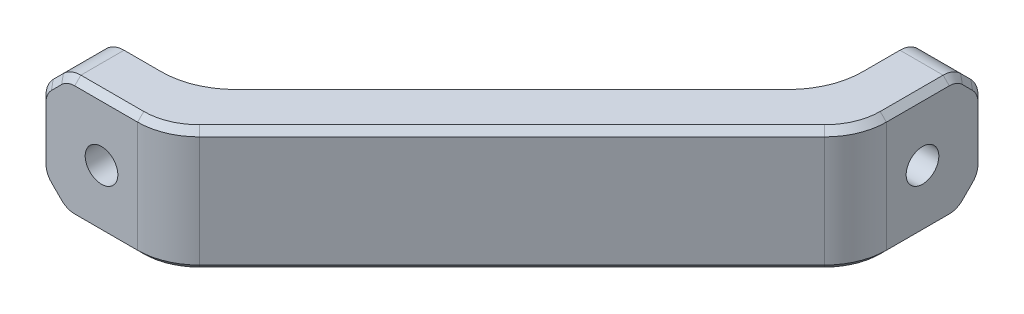
from build123d import *

# Parameters (mm, degrees)
BOSS_EXTRUDE1_DEPTH = 20
SKETCH2_R           = 2.65
CUT_EXTRUDE1_DEPTH  = 20
SKETCH3_R           = 2.65
CUT_EXTRUDE2_DEPTH  = 20
SKETCH7_R           = 6
CUT_EXTRUDE4_DEPTH  = 5
SKETCH8_R           = 6
CUT_EXTRUDE5_DEPTH  = 5
CHAMFER3_SIZE       = 4
FILLET2_R           = 4
CHAMFER4_SIZE       = 2
CHAMFER5_SIZE       = 1


with BuildPart() as part:
    # Sketch1 → Boss-Extrude1 (new body)
    with BuildSketch(Plane(origin=(0, 0, 0), x_dir=(1, 0, 0), z_dir=(0, 1, 0))):
        with BuildLine():
            Line((-4.142135624, 0), (-20, 0))
            Line((-20, 0), (-20, 10))
            Line((-20, 10), (-8.284271247, 10))
            ThreePointArc((-8.284271247, 10), (-4.457436924, 10.761204675), (-1.213203436, 12.928932188))
            Line((-1.213203436, 12.928932188), (43.639610307, 57.781745931))
            ThreePointArc((43.639610307, 57.781745931), (45.80733782, 61.025979419), (46.568542495, 64.852813742))
            Line((46.568542495, 64.852813742), (46.568542495, 76.568542495))
            Line((46.568542495, 76.568542495), (56.568542495, 76.568542495))
            Line((56.568542495, 76.568542495), (56.568542495, 60.710678119))
            ThreePointArc((56.568542495, 60.710678119), (55.80733782, 56.883843795), (53.639610307, 53.639610307))
            Line((53.639610307, 53.639610307), (2.928932188, 2.928932188))
            ThreePointArc((2.928932188, 2.928932188), (-0.3153013, 0.761204675), (-4.142135624, 0))
        make_face()
    extrude(amount=BOSS_EXTRUDE1_DEPTH)

    # Sketch2 → Cut-Extrude1 (cut)
    with BuildSketch(Plane.XY):
        with Locations((-10, 10)):
            Circle(SKETCH2_R)
    extrude(amount=-CUT_EXTRUDE1_DEPTH, mode=Mode.SUBTRACT)

    # Sketch3 → Cut-Extrude2 (cut)
    with BuildSketch(Plane(origin=(56.568542495, 0, 0), x_dir=(0, 0, -1), z_dir=(1, 0, 0))):
        with Locations((66.568542495, 10)):
            Circle(SKETCH3_R)
    extrude(amount=-CUT_EXTRUDE2_DEPTH, mode=Mode.SUBTRACT)

    # Sketch7 → Cut-Extrude4 (cut)
    with BuildSketch(Plane.ZY.offset(-46.568542495)):
        with Locations((-66.568542495, 10)):
            Circle(SKETCH7_R)
    extrude(amount=CUT_EXTRUDE4_DEPTH, mode=Mode.SUBTRACT)

    # Sketch8 → Cut-Extrude5 (cut)
    with BuildSketch(Plane(origin=(0, 0, -10), x_dir=(-1, 0, 0), z_dir=(0, 0, -1))):
        with Locations((10, 10)):
            Circle(SKETCH8_R)
    extrude(amount=CUT_EXTRUDE5_DEPTH, mode=Mode.SUBTRACT)

    # Chamfer3
    chamfer3_edges = [part.edges().sort_by_distance(p)[0] for p in [
        (51.568542495, 0, -76.568542495),
        (-20, 0, -5),
        (51.568542495, 20, -76.568542495),
        (-20, 20, -5),
    ]]
    chamfer(chamfer3_edges, length=CHAMFER3_SIZE)

    # Fillet2
    fillet2_edges = [part.edges().sort_by_distance(p)[0] for p in [
        (-16, 20, -5),
        (51.568542495, 20, -72.568542495),
        (51.568542495, 4, -76.568542495),
        (51.568542495, 16, -76.568542495),
        (-16, 0, -5),
        (51.568542495, 0, -72.568542495),
        (-20, 16, -5),
        (-20, 4, -5),
    ]]
    fillet(fillet2_edges, radius=FILLET2_R)

    # Chamfer4
    chamfer4_edges = [part.edges().sort_by_distance(p)[0] for p in [
        (46.568542495, 20, -67.882250994),
        (46.568542495, 18, -74.568542495),
        (46.568542495, 2, -74.568542495),
        (46.568542495, 0, -67.882250994),
        (46.568542495, 15.87387948, -76.264060625),
        (46.568542495, 19.69551813, -72.442421975),
        (46.568542495, 0.30448187, -72.442421975),
        (46.568542495, 4.12612052, -76.264060625),
        (-18, 18, -10),
        (-11.313708499, 0, -10),
        (-18, 2, -10),
        (-20, 10, -10),
        (-19.69551813, 4.12612052, -10),
        (-15.87387948, 0.30448187, -10),
        (-19.69551813, 15.87387948, -10),
        (-15.87387948, 19.69551813, -10),
        (-4.457436924, 0, -10.761204675),
        (21.213203436, 0, -35.355339059),
        (45.80733782, 0, -61.025979419),
        (45.80733782, 20, -61.025979419),
        (21.213203436, 20, -35.355339059),
        (-4.457436924, 20, -10.761204675),
        (-11.313708499, 20, -10),
        (46.568542495, 10, -76.568542495),
    ]]
    chamfer(chamfer4_edges, length=CHAMFER4_SIZE)

    # Chamfer5
    chamfer5_edges = [part.edges().sort_by_distance(p)[0] for p in [
        (56.568542495, 2, -74.568542495),
        (56.568542495, 18, -74.568542495),
        (56.568542495, 15.87387948, -76.264060625),
        (56.568542495, 19.69551813, -72.442421975),
        (56.568542495, 0.30448187, -72.442421975),
        (56.568542495, 4.12612052, -76.264060625),
        (-9.242640687, 0, 0),
        (-9.242640687, 20, 0),
        (-20, 10, 0),
        (-18, 2, 0),
        (-18, 18, 0),
        (-19.69551813, 4.12612052, 0),
        (-15.87387948, 0.30448187, 0),
        (-19.69551813, 15.87387948, 0),
        (-15.87387948, 19.69551813, 0),
        (-0.3153013, 20, -0.761204675),
        (56.568542495, 0, -65.811183182),
        (55.80733782, 0, -56.883843795),
        (28.284271247, 0, -28.284271247),
        (-0.3153013, 0, -0.761204675),
        (28.284271247, 20, -28.284271247),
        (55.80733782, 20, -56.883843795),
        (56.568542495, 20, -65.811183182),
        (56.568542495, 10, -76.568542495),
    ]]
    chamfer(chamfer5_edges, length=CHAMFER5_SIZE)


solid = part.part
